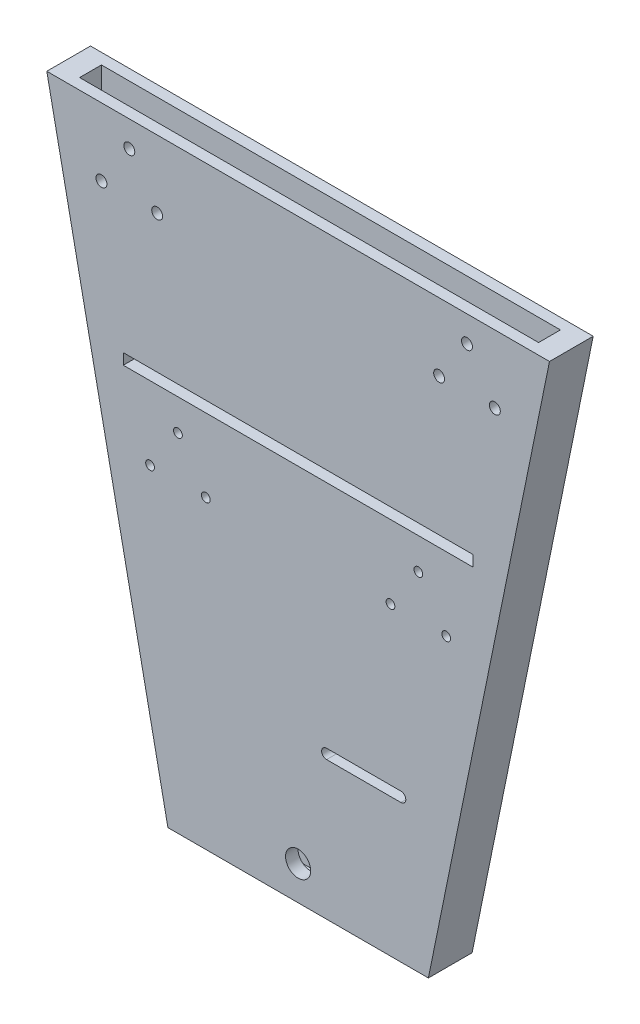
from build123d import *

# Parameters (mm, degrees)
EXTRUDE_1_DEPTH     = 20
SKETCH_3_W          = 210
SKETCH_3_H          = 10
CUT_EXTRUDE_1_DEPTH = 15
SKETCH_4_W          = 160
SKETCH_4_H          = 5
CUT_EXTRUDE_2_DEPTH = 10
SKETCH_5_R          = 2.5
SKETCH_5_R_2        = 2
CUT_EXTRUDE_3_DEPTH = 10
CUT_EXTRUDE_4_DEPTH = 4.3
SKETCH_8_R          = 5.75
CUT_EXTRUDE_6_DEPTH = 15
CUT_EXTRUDE_7_DEPTH = 250.048188108
CUT_EXTRUDE_START   = -8
CUT_EXTRUDE_8_DEPTH = 8


with BuildPart() as part:
    # 草图1 → 凸台-拉伸1 (new body)
    with BuildSketch(Plane.XY):
        Polygon((-115, 220), (115, 220), (60, -50), (59.592592593, -52), (-59.592592593, -52), (-60, -50), align=None)
    extrude(amount=EXTRUDE_1_DEPTH)

    # 草图3 → 切除-拉伸1 (cut)
    with BuildSketch(Plane(origin=(0, 220, 0), x_dir=(1, 0, 0), z_dir=(0, 1, 0))):
        with Locations((0, -10)):
            Rectangle(SKETCH_3_W, SKETCH_3_H)
    extrude(amount=-CUT_EXTRUDE_1_DEPTH, mode=Mode.SUBTRACT)

    # 草图4 → 切除-拉伸2 (cut)
    with BuildSketch(Plane.XY.offset(20)):
        with Locations((0, 123.51)):
            Rectangle(SKETCH_4_W, SKETCH_4_H)
    extrude(amount=-CUT_EXTRUDE_2_DEPTH, mode=Mode.SUBTRACT)

    # 草图5 → 切除-拉伸3 (cut)
    with BuildSketch(Plane.XY.offset(20)):
        with Locations((-77.25, 208.1425573)):
            Circle(SKETCH_5_R)
        with Locations((-90, 189)):
            Circle(SKETCH_5_R)
        with Locations((-64.5, 189)):
            Circle(SKETCH_5_R)
        with Locations((-55, 106.6525573)):
            Circle(SKETCH_5_R_2)
        with Locations((-67.75, 87.51)):
            Circle(SKETCH_5_R_2)
        with Locations((-42.25, 87.51)):
            Circle(SKETCH_5_R_2)
        with Locations(Location((42.25, 87.51, 0), (0, 0, 180))):
            Circle(SKETCH_5_R_2)
        with Locations(Location((67.75, 87.51, 0), (0, 0, 180))):
            Circle(SKETCH_5_R_2)
        with Locations(Location((55, 106.6525573, 0), (0, 0, 180))):
            Circle(SKETCH_5_R_2)
        with Locations(Location((64.5, 189, 0), (0, 0, 180))):
            Circle(SKETCH_5_R)
        with Locations(Location((90, 189, 0), (0, 0, 180))):
            Circle(SKETCH_5_R)
        with Locations((77.25, 208.1425573)):
            Circle(SKETCH_5_R)
    extrude(amount=-CUT_EXTRUDE_3_DEPTH, mode=Mode.SUBTRACT)

    # 草图6 → 切除-拉伸4 (cut, symmetric)
    with BuildSketch(Plane(origin=(0, 0, 10), x_dir=(-1, 0, 0), z_dir=(0, 0, -1))):
        with BuildLine():
            Line((0, -49.69), (17.486671343, -49.69))
            Line((17.486671343, -49.69), (12.108893566, -23.29))
            Line((12.108893566, -23.29), (0, -23.29))
            ThreePointArc((0, -23.29), (-13.2, -36.49), (0, -49.69))
        make_face()
    extrude(amount=CUT_EXTRUDE_4_DEPTH, both=True, mode=Mode.SUBTRACT)

    # 草图8 → 切除-拉伸6 (cut)
    with BuildSketch(Plane.XY.offset(20)):
        with Locations((0, -36.49)):
            Circle(SKETCH_8_R)
    extrude(amount=-CUT_EXTRUDE_6_DEPTH, mode=Mode.SUBTRACT)

    # 草图9 → 切除-拉伸7 (cut, through all)
    with BuildSketch(Plane.XY.offset(20)):
        with BuildLine():
            Line((13, 11.26), (47, 11.26))
            ThreePointArc((47, 11.26), (49.25, 13.51), (47, 15.76))
            Line((47, 15.76), (13, 15.76))
            ThreePointArc((13, 15.76), (10.75, 13.51), (13, 11.26))
        make_face()
    extrude(amount=-CUT_EXTRUDE_7_DEPTH, mode=Mode.SUBTRACT)

    # 草图10 → 切除-拉伸8 (cut)
    with BuildSketch(Plane(origin=(0, 0, 0), x_dir=(-1, 0, 0), z_dir=(0, 0, -1)).offset(CUT_EXTRUDE_START)):
        with BuildLine():
            Line((-50, 9.51), (-10, 9.51))
            ThreePointArc((-10, 9.51), (-6, 13.51), (-10, 17.51))
            Line((-10, 17.51), (-50, 17.51))
            ThreePointArc((-50, 17.51), (-54, 13.51), (-50, 9.51))
        make_face()
        with BuildLine():
            Line((-47, 15.76), (-13, 15.76))
            ThreePointArc((-13, 15.76), (-10.75, 13.51), (-13, 11.26))
            Line((-13, 11.26), (-47, 11.26))
            ThreePointArc((-47, 11.26), (-49.25, 13.51), (-47, 15.76))
        make_face(mode=Mode.SUBTRACT)
    extrude(amount=CUT_EXTRUDE_8_DEPTH, mode=Mode.SUBTRACT)


solid = part.part
